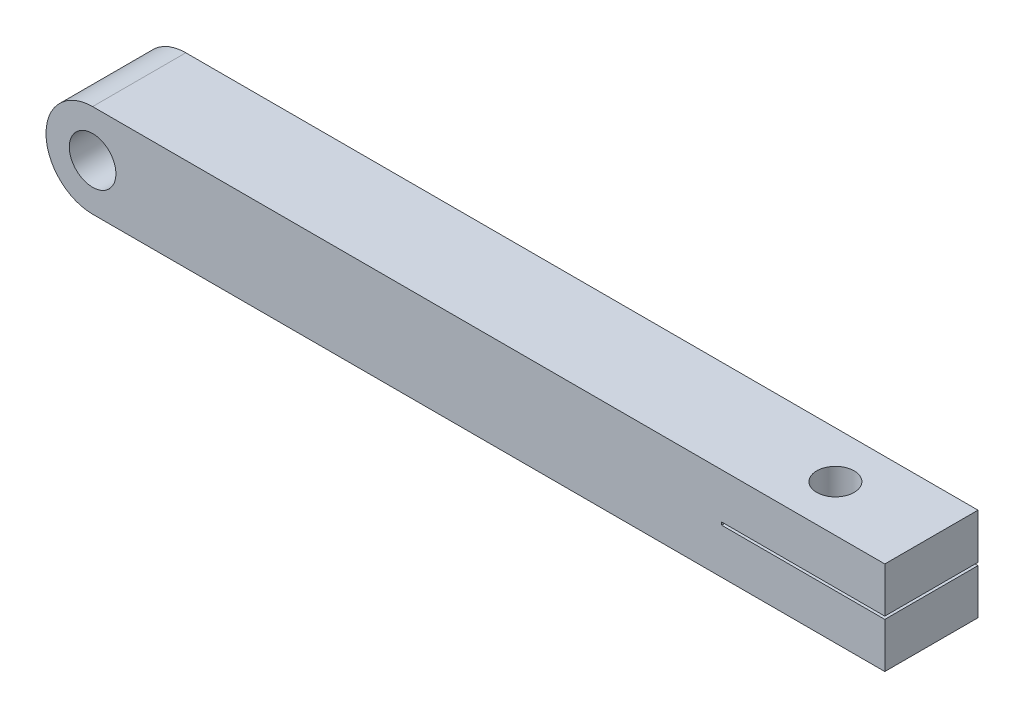
from build123d import *

# Parameters (mm, degrees)
SKETCH1_R              = 3.175
BOSS_EXTRUDE1_DEPTH    = 12.7
F_10_CLEARANCE_HOLE2_D = 5.1054


with BuildPart() as part:
    # Sketch1 → Boss-Extrude1 (new body)
    with BuildSketch(Plane.XY):
        with BuildLine():
            Line((85.725, 0.1905), (85.725, -0.1905))
            Line((85.725, -0.1905), (107.95, -0.1905))
            Line((107.95, -0.1905), (107.95, -6.35))
            Line((107.95, -6.35), (7.14e-07, -6.35))
            ThreePointArc((7.14e-07, -6.35), (-6.35, -3.57e-07), (0, 6.35))
            Line((0, 6.35), (107.95, 6.35))
            Line((107.95, 6.35), (107.95, 0.1905))
            Line((107.95, 0.1905), (85.725, 0.1905))
        make_face()
        Circle(SKETCH1_R, mode=Mode.SUBTRACT)
    extrude(amount=BOSS_EXTRUDE1_DEPTH)

    # #10 Clearance Hole2 (through all)
    with Locations(Plane(origin=(0, 6.35, 0), x_dir=(1, 0, 0), z_dir=(0, 1, 0))):
        with Locations((94.869, -6.35)):
            Hole(F_10_CLEARANCE_HOLE2_D / 2)


solid = part.part
